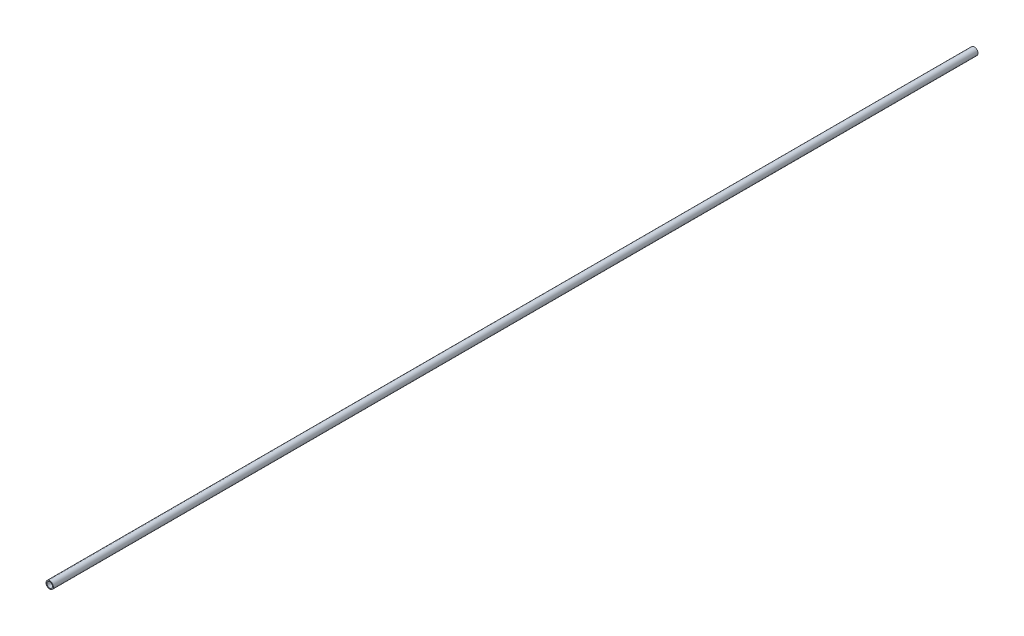
from build123d import *

# Parameters (mm, degrees)
SKETCH1_R           = 4
BOSS_EXTRUDE1_DEPTH = 500
SHELL1_T            = -1


with BuildPart() as part:
    # Sketch1 → Boss-Extrude1 (new, symmetric)
    with BuildSketch(Plane.XY):
        Circle(SKETCH1_R)
    extrude(amount=BOSS_EXTRUDE1_DEPTH, both=True)

    # Shell1
    shell1_openings = [part.faces().sort_by_distance(p)[0] for p in [
        (0, 0, 500),
        (0, 0, -500),
    ]]
    offset(amount=SHELL1_T, openings=shell1_openings, kind=Kind.INTERSECTION)


solid = part.part
